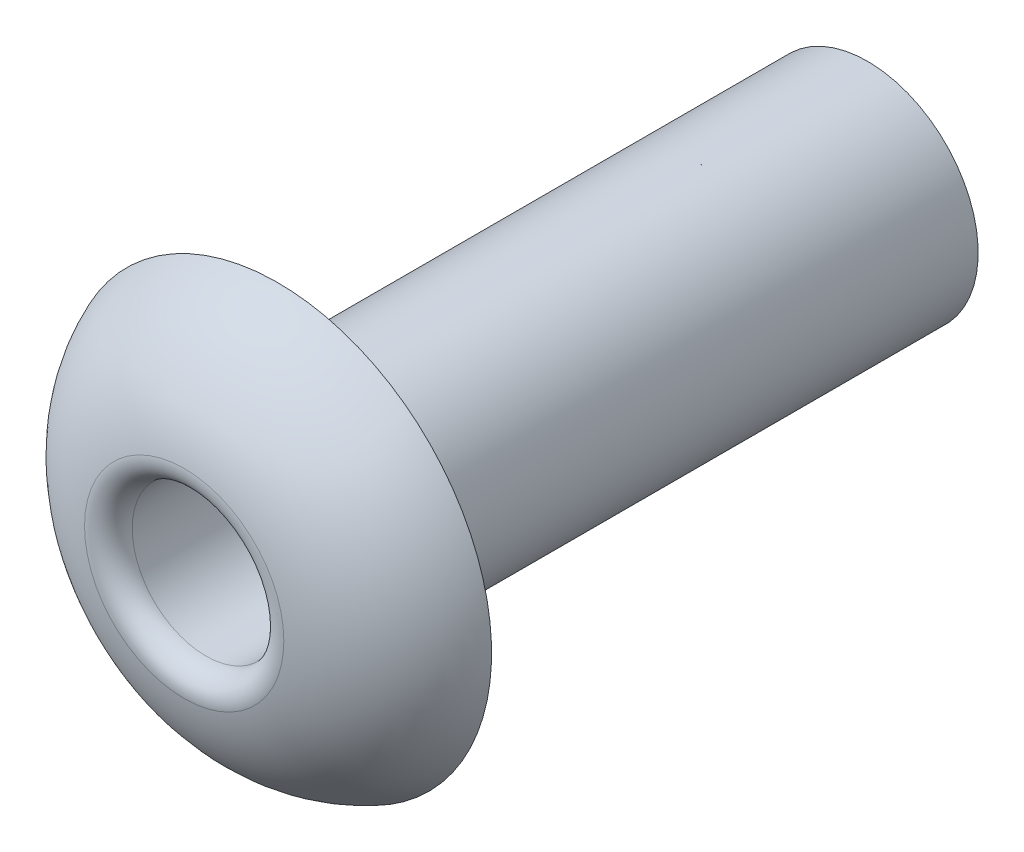
from build123d import *

# Parameters (mm, degrees)
FILLET_528_R = 0.3


with BuildPart() as part:
    # 草图1 → 旋转1 (revolve)
    with BuildSketch(Plane(origin=(0, 0, 0), x_dir=(0, 0, -1), z_dir=(1, 0, 0)), mode=Mode.PRIVATE) as revolve_1_sk:
        with BuildLine():
            Line((0, 1.5), (0, 2.9))
            ThreePointArc((0, 2.9), (-0.943895571, 2.151086443), (-1.3, 1))
            Line((-1.3, 1), (8, 1))
            Line((8, 1), (8, 1.5))
            Line((8, 1.5), (0, 1.5))
        make_face()
    revolve(revolve_1_sk.sketch.rotate(Axis((0, 0, -4), (0, 0, 1)), 90), axis=Axis((0, 0, -4), (0, 0, 1)))

    # Fillet 528
    fillet_528_edges = [part.edges().sort_by_distance(p)[0] for p in [
        (1, 0, 1.3),
    ]]
    fillet(fillet_528_edges, radius=FILLET_528_R)


solid = part.part
